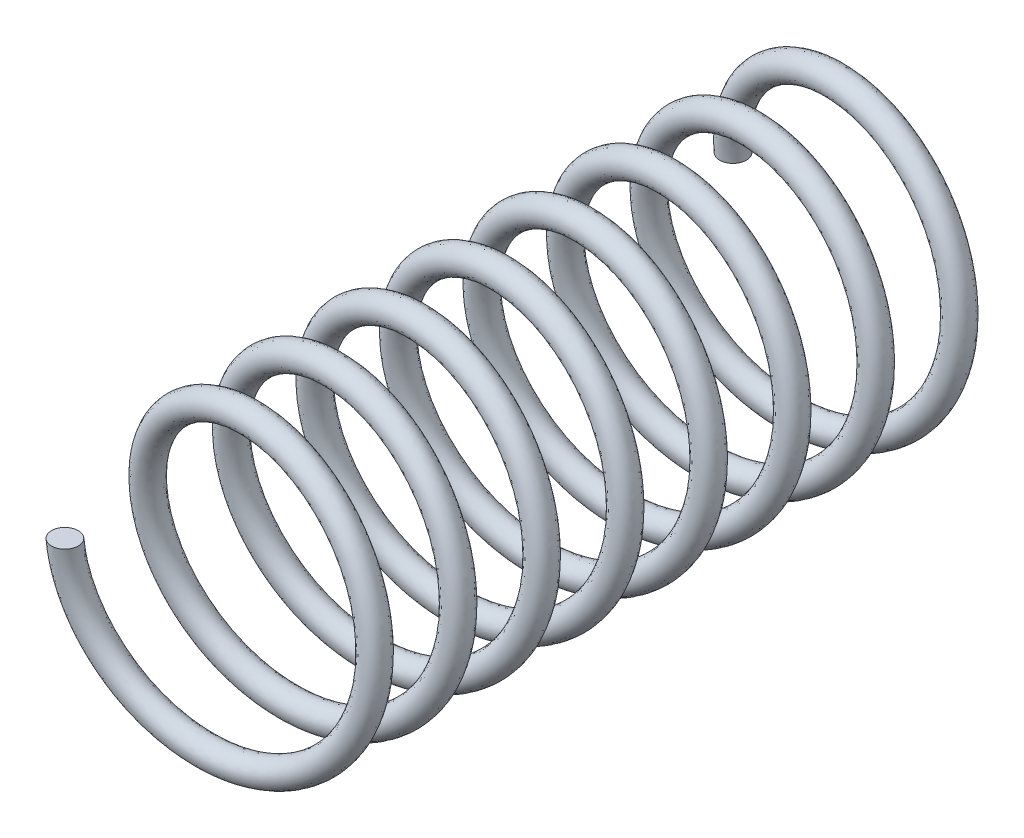
from build123d import *

# Parameters (mm, degrees)
SWEEP1_PITCH       = 6.25
SWEEP1_HEIGHT      = 50
SWEEP1_RADIUS      = 10
SWEEP1_START_ANGLE = -180
SCHIZZO2_R         = 1


with BuildPart() as part:
    # Sweep1: sweep along a helix
    with BuildLine() as sweep1_path:
        add(Helix(SWEEP1_PITCH, SWEEP1_HEIGHT, SWEEP1_RADIUS, center=(0, 0, 0), direction=(0, 0, 1), lefthand=True, mode=Mode.PRIVATE).rotate(Axis((0, 0, 0), (0, 0, 1)), SWEEP1_START_ANGLE))
    # Schizzo2 → Sweep1 (sweep)
    with BuildSketch(Plane(origin=(0, 0, 0), x_dir=(1, 0, 0), z_dir=(0, 1, 0))):
        with Locations((-10, 0)):
            Circle(SCHIZZO2_R)
    sweep(path=sweep1_path.line, is_frenet=True)


solid = part.part
